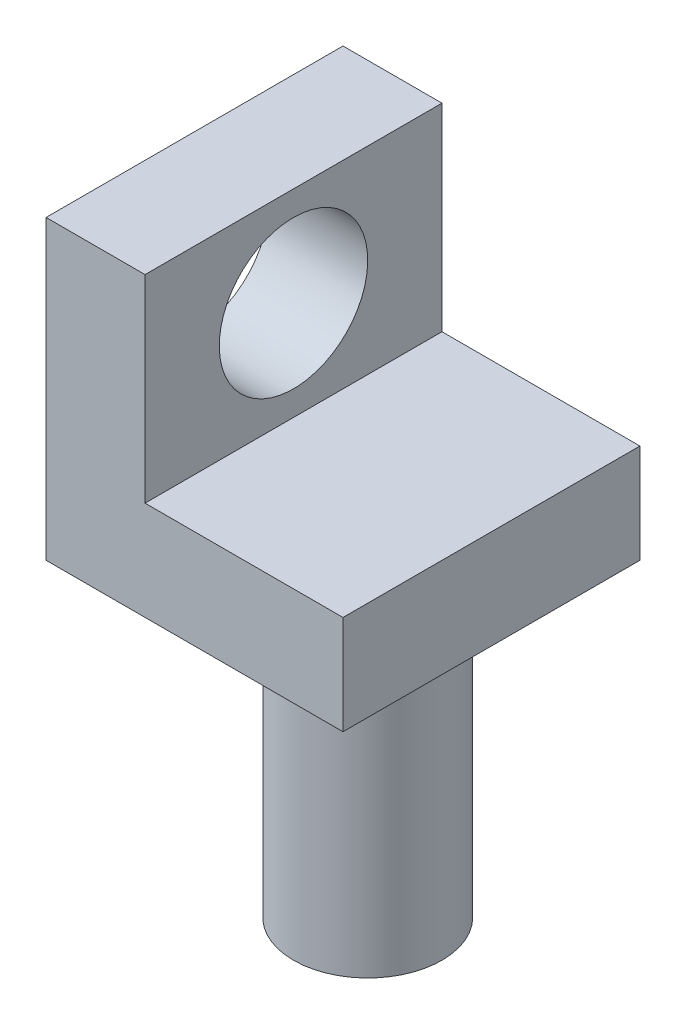
from build123d import *

# Parameters (mm, degrees)
SKETCH2_R           = 7.5
ROTAITING_PIN_DEPTH = 30
BODY_DEPTH          = 15
SKETCH4_R           = 7.5
HOLE_DEPTH          = 30


with BuildPart() as part:
    # Sketch2 → rotaiting pin (new body)
    with BuildSketch(Plane(origin=(0, 0, 0), x_dir=(1, 0, 0), z_dir=(0, 1, 0))):
        with Locations(Location((0, 0, 0), (0, 0, 270))):
            Circle(SKETCH2_R)
    extrude(amount=ROTAITING_PIN_DEPTH)

    # Sketch3 → body (add, symmetric)
    with BuildSketch(Plane.XY):
        Polygon((-17.5, 60), (-7.5, 60), (-7.5, 40), (12.5, 40), (12.5, 30), (-17.5, 30), align=None)
    extrude(amount=BODY_DEPTH, both=True)

    # Sketch4 → hole (cut)
    with BuildSketch(Plane(origin=(-7.5, 0, 0), x_dir=(0, 0, -1), z_dir=(1, 0, 0))):
        with Locations(Location((0, 50, 0), (0, 0, 90))):
            Circle(SKETCH4_R)
    extrude(amount=-HOLE_DEPTH, mode=Mode.SUBTRACT)


solid = part.part
